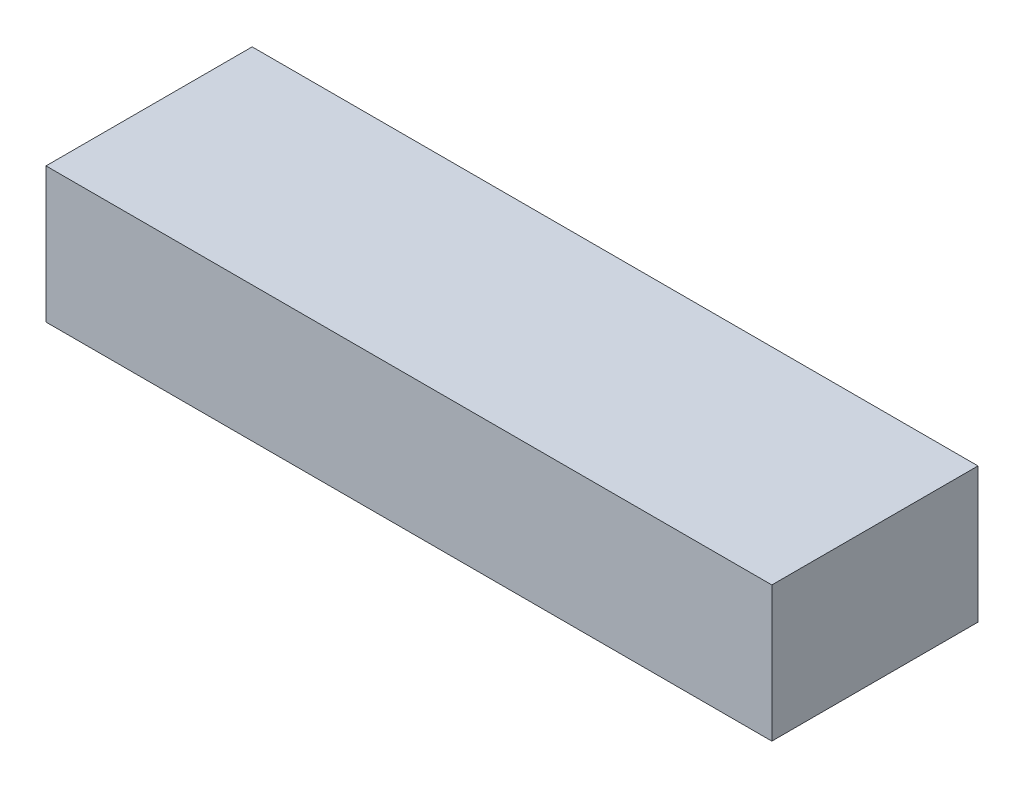
from build123d import *

# Parameters (mm, degrees)
SKETCH1_W           = 169
SKETCH1_H           = 48
BOSS_EXTRUDE1_DEPTH = 31.5


with BuildPart() as part:
    # Sketch1 → Boss-Extrude1 (new body)
    with BuildSketch(Plane(origin=(0, 0, 0), x_dir=(1, 0, 0), z_dir=(0, 1, 0))):
        Rectangle(SKETCH1_W, SKETCH1_H)
    extrude(amount=BOSS_EXTRUDE1_DEPTH)


solid = part.part
